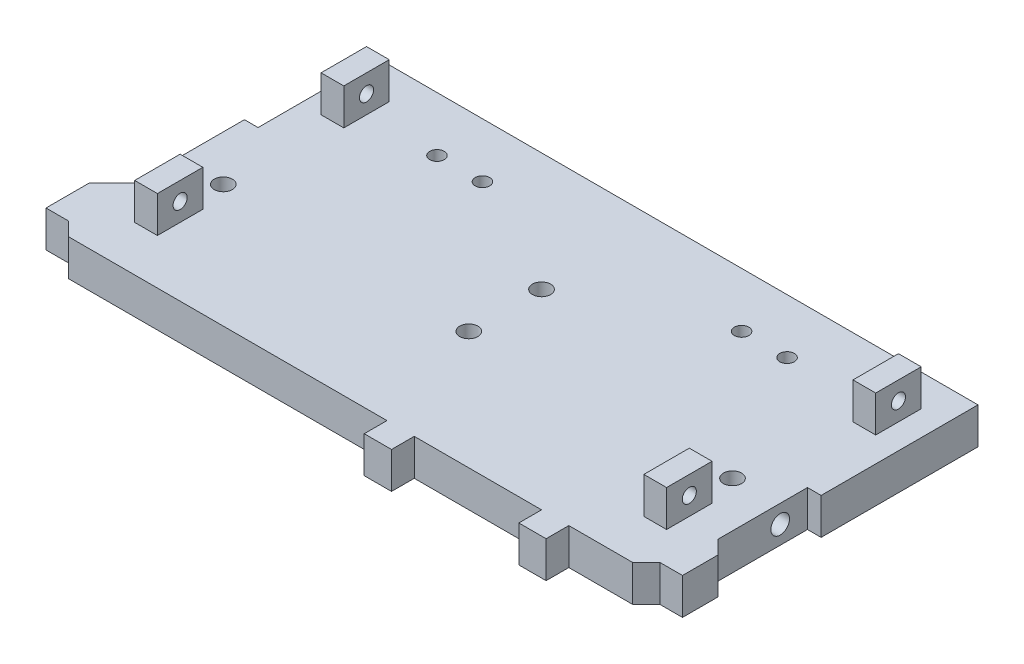
from build123d import *

# Parameters (mm, degrees)
BOSS_EXTRUDE1_DEPTH = 8
SKETCH2_R           = 2
CUT_EXTRUDE1_DEPTH  = 81.529497701
SKETCH3_R           = 2
SKETCH3_R_2         = 1.6
CUT_EXTRUDE2_DEPTH  = 81.529497701
SKETCH4_R           = 2.05
CUT_EXTRUDE3_DEPTH  = 6
SKETCH5_W           = 5
SKETCH5_H           = 10
BOSS_EXTRUDE2_DEPTH = 8
SKETCH6_R           = 1.55
CUT_EXTRUDE4_DEPTH  = 135.287936912


with BuildPart() as part:
    # Sketch1 → Boss-Extrude1 (new body)
    with BuildSketch(Plane(origin=(0, 0, 0), x_dir=(1, 0, 0), z_dir=(0, 1, 0))):
        Polygon((70, 34), (-62, 34), (-62, 7.645012604), (-65, 7.645012604), (-65, -16.427077226), (-70, -21.427077226), (-70, -31), (-65, -31), (-62, -34), (8, -34), (8, -39), (14, -39), (14, -34), (42, -34), (42, -39), (48, -39), (48, -34), (62, -34), (65, -31), (70, -31), (70, -23.155364425), (67, -20.155364425), (67, -0.506394588), (70, -0.506394588), align=None)
    extrude(amount=BOSS_EXTRUDE1_DEPTH)

    # Sketch2 → Cut-Extrude1 (cut, through all)
    with BuildSketch(Plane(origin=(0, 8, 0), x_dir=(1, 0, 0), z_dir=(0, 1, 0))):
        with Locations(Location((0, 8, 0), (0, 0, 270))):
            Circle(SKETCH2_R)
        with Locations(Location((0, -8, 0), (0, 0, 270))):
            Circle(SKETCH2_R)
    extrude(amount=-CUT_EXTRUDE1_DEPTH, mode=Mode.SUBTRACT)

    # Sketch3 → Cut-Extrude2 (cut, through all)
    with BuildSketch(Plane(origin=(0, 8, 0), x_dir=(1, 0, 0), z_dir=(0, 1, 0))):
        with Locations(Location((57, -7, 0), (0, 0, 270))):
            Circle(SKETCH3_R)
        with Locations(Location((-37, 22, 0), (0, 0, 270))):
            Circle(SKETCH3_R_2)
        with Locations(Location((-27, 22, 0), (0, 0, 270))):
            Circle(SKETCH3_R_2)
        with Locations(Location((30, 22, 0), (0, 0, 270))):
            Circle(SKETCH3_R_2)
        with Locations(Location((40, 22, 0), (0, 0, 270))):
            Circle(SKETCH3_R_2)
        with Locations(Location((-55, -7, 0), (0, 0, 270))):
            Circle(SKETCH3_R)
    extrude(amount=-CUT_EXTRUDE2_DEPTH, mode=Mode.SUBTRACT)

    # Sketch4 → Cut-Extrude3 (cut)
    with BuildSketch(Plane(origin=(67, 0, 0), x_dir=(0, 0, -1), z_dir=(1, 0, 0))):
        with Locations((-6.506394588, 4)):
            Circle(SKETCH4_R)
    extrude(amount=-CUT_EXTRUDE3_DEPTH, mode=Mode.SUBTRACT)

    # Sketch5 → Boss-Extrude2 (add)
    with BuildSketch(Plane(origin=(0, 8, 0), x_dir=(1, 0, 0), z_dir=(0, 1, 0))):
        with Locations((-55, -19)):
            Rectangle(SKETCH5_W, SKETCH5_H)
        with Locations((-55, 22)):
            Rectangle(SKETCH5_W, SKETCH5_H)
        with Locations((57, -19)):
            Rectangle(SKETCH5_W, SKETCH5_H)
        with Locations((62, 22)):
            Rectangle(SKETCH5_W, SKETCH5_H)
    extrude(amount=BOSS_EXTRUDE2_DEPTH)

    # Sketch6 → Cut-Extrude4 (cut, through all)
    with BuildSketch(Plane.ZY.offset(57.5)):
        with Locations((-22, 12)):
            Circle(SKETCH6_R)
        with Locations((19, 12)):
            Circle(SKETCH6_R)
    extrude(amount=-CUT_EXTRUDE4_DEPTH, mode=Mode.SUBTRACT)


solid = part.part
